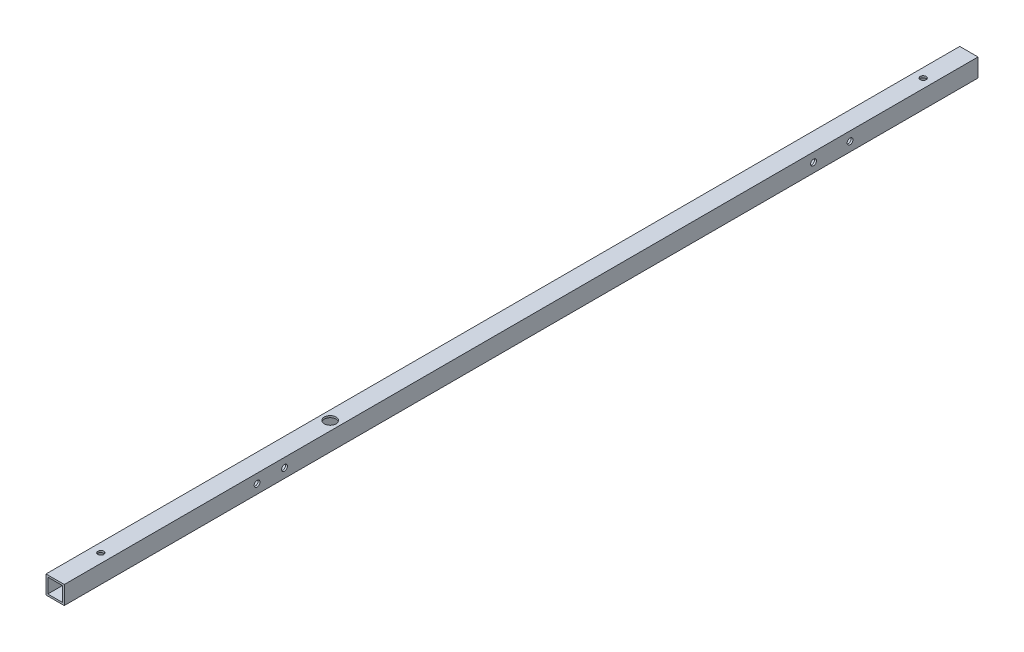
from build123d import *

# Parameters (mm, degrees)
SKETCH1_W           = 10
SKETCH1_H           = 10
SKETCH1_W_2         = 8
SKETCH1_H_2         = 8
BOSS_EXTRUDE1_DEPTH = 500
CUT_EXTRUDE1_REACH  = 502.125
SKETCH2_R           = 1.6
CUT_EXTRUDE2_REACH  = 502.125
SKETCH3_R           = 1.6
SKETCH4_R           = 1.6
CUT_EXTRUDE3_DEPTH  = 10
SKETCH5_R           = 3.25
CUT_EXTRUDE4_DEPTH  = 1


with BuildPart() as part:
    # Sketch1 → Boss-Extrude1 (new body)
    with BuildSketch(Plane.XY):
        Rectangle(SKETCH1_W, SKETCH1_H)
        Rectangle(SKETCH1_W_2, SKETCH1_H_2, mode=Mode.SUBTRACT)
    extrude(amount=BOSS_EXTRUDE1_DEPTH)

    # Cut-Extrude1: up to this face of the body (flat: up to its plane)
    cut_extrude1_end = Plane(part.part.faces().sort_by_distance((0, -5, 250))[0])
    # Sketch2 → Cut-Extrude1 (cut, up to the picked face)
    with BuildSketch(Plane(origin=(0, 5, 0), x_dir=(1, 0, 0), z_dir=(0, 1, 0)), mode=Mode.PRIVATE) as cut_extrude1_sk1:
        with Locations(Location((0, -349.5, 0), (0, 0, 270))):
            Circle(SKETCH2_R)
    cut_extrude1_tool1 = split(extrude(cut_extrude1_sk1.sketch, amount=-CUT_EXTRUDE1_REACH, mode=Mode.PRIVATE), bisect_by=cut_extrude1_end, keep=Keep.BOTH, mode=Mode.PRIVATE)
    add(cut_extrude1_tool1.solids().sort_by(Axis((0, 5, 349.5), (0, -1, 0)))[0], mode=Mode.SUBTRACT)

    # Cut-Extrude2: up to this face of the body (flat: up to its plane)
    cut_extrude2_end = Plane(part.part.faces().sort_by_distance((0, -5, 249.839696857))[0])
    # Sketch3 → Cut-Extrude2 (cut, up to the picked face)
    with BuildSketch(Plane(origin=(0, 5, 0), x_dir=(1, 0, 0), z_dir=(0, 1, 0)), mode=Mode.PRIVATE) as cut_extrude2_sk1:
        with Locations(Location((0, -475, 0), (0, 0, 270))):
            Circle(SKETCH3_R)
    cut_extrude2_tool1 = split(extrude(cut_extrude2_sk1.sketch, amount=-CUT_EXTRUDE2_REACH, mode=Mode.PRIVATE), bisect_by=cut_extrude2_end, keep=Keep.BOTH, mode=Mode.PRIVATE)
    # Sketch3 → Cut-Extrude2 (cut, up to the picked face)
    with BuildSketch(Plane(origin=(0, 5, 0), x_dir=(1, 0, 0), z_dir=(0, 1, 0)), mode=Mode.PRIVATE) as cut_extrude2_sk2:
        with Locations(Location((0, -25, 0), (0, 0, 270))):
            Circle(SKETCH3_R)
    cut_extrude2_tool2 = split(extrude(cut_extrude2_sk2.sketch, amount=-CUT_EXTRUDE2_REACH, mode=Mode.PRIVATE), bisect_by=cut_extrude2_end, keep=Keep.BOTH, mode=Mode.PRIVATE)
    add(cut_extrude2_tool1.solids().sort_by(Axis((0, 5, 475), (0, -1, 0)))[0], mode=Mode.SUBTRACT)
    add(cut_extrude2_tool2.solids().sort_by(Axis((0, 5, 25), (0, -1, 0)))[0], mode=Mode.SUBTRACT)

    # Sketch4 → Cut-Extrude3 (cut)
    with BuildSketch(Plane(origin=(5, 0, 0), x_dir=(0, 0, -1), z_dir=(1, 0, 0))):
        with Locations(Location((-70, 0, 0), (0, 0, 90))):
            Circle(SKETCH4_R)
        with Locations(Location((-90, 0, 0), (0, 0, 90))):
            Circle(SKETCH4_R)
        with Locations(Location((-394.5, 0, 0), (0, 0, 90))):
            Circle(SKETCH4_R)
        with Locations(Location((-379.5, 0, 0), (0, 0, 90))):
            Circle(SKETCH4_R)
    extrude(amount=-CUT_EXTRUDE3_DEPTH, mode=Mode.SUBTRACT)

    # Sketch5 → Cut-Extrude4 (cut)
    with BuildSketch(Plane(origin=(0, 5, 0), x_dir=(1, 0, 0), z_dir=(0, 1, 0))):
        with Locations(Location((0, -349.5, 0), (0, 0, 270))):
            Circle(SKETCH5_R)
    extrude(amount=-CUT_EXTRUDE4_DEPTH, mode=Mode.SUBTRACT)


solid = part.part
